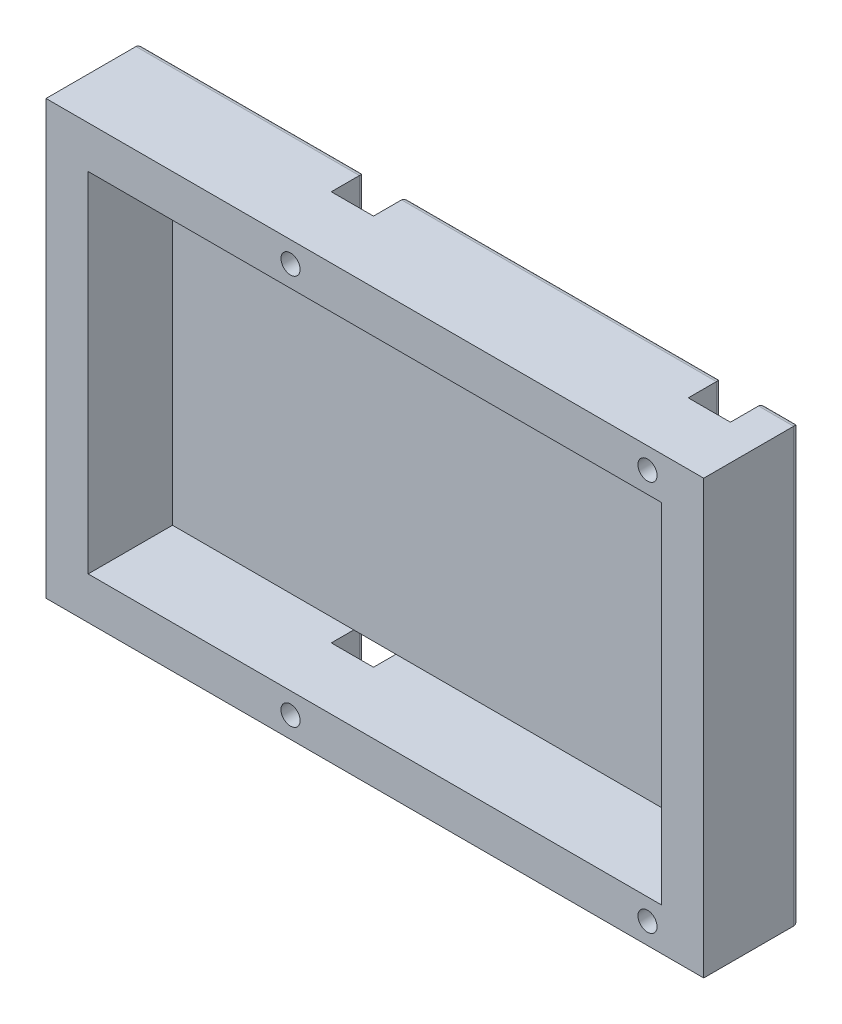
from build123d import *

# Parameters (mm, degrees)
SKETCH_1_W          = 117
SKETCH_1_H          = 77
EXTRUDE_1_DEPTH     = 17
SKETCH_2_W          = 102
SKETCH_2_H          = 62
CUT_EXTRUDE_1_DEPTH = 15
SKETCH_4_R          = 1.7
CUT_EXTRUDE_2_DEPTH = 73.065942025
SKETCH_5_W          = 7.5
SKETCH_5_H          = 7.5
CUT_EXTRUDE_3_DEPTH = 6
FILLET_2_R          = 1


with BuildPart() as part:
    # ｽｹｯﾁ1 → ﾎﾞｽ - 押し出し1 (new body)
    with BuildSketch(Plane.XY):
        Rectangle(SKETCH_1_W, SKETCH_1_H)
    extrude(amount=EXTRUDE_1_DEPTH)

    # ｽｹｯﾁ2 → ｶｯﾄ - 押し出し1 (cut)
    with BuildSketch(Plane.XY.offset(17)):
        Rectangle(SKETCH_2_W, SKETCH_2_H)
    extrude(amount=-CUT_EXTRUDE_1_DEPTH, mode=Mode.SUBTRACT)

    # ｽｹｯﾁ4 → ｶｯﾄ - 押し出し2 (cut, through all)
    with BuildSketch(Plane(origin=(0, 0, 0), x_dir=(-1, 0, 0), z_dir=(0, 0, -1))):
        with Locations((15, 34.75)):
            Circle(SKETCH_4_R)
        with Locations((15, -34.75)):
            Circle(SKETCH_4_R)
        with Locations((-48.5, -34.75)):
            Circle(SKETCH_4_R)
        with Locations((-48.5, 34.75)):
            Circle(SKETCH_4_R)
    extrude(amount=-CUT_EXTRUDE_2_DEPTH, mode=Mode.SUBTRACT)

    # ｽｹｯﾁ5 → ｶｯﾄ - 押し出し3 (cut)
    with BuildSketch(Plane(origin=(0, 0, 0), x_dir=(-1, 0, 0), z_dir=(0, 0, -1))):
        with Locations((-48.5, -34.75)):
            Rectangle(SKETCH_5_W, SKETCH_5_H)
        with Locations((-48.5, 34.75)):
            Rectangle(SKETCH_5_W, SKETCH_5_H)
        with Locations((15, 34.75)):
            Rectangle(SKETCH_5_W, SKETCH_5_H)
        with Locations((15, -34.75)):
            Rectangle(SKETCH_5_W, SKETCH_5_H)
    extrude(amount=-CUT_EXTRUDE_3_DEPTH, mode=Mode.SUBTRACT)

    # ﾌｨﾚｯﾄ2
    fillet_2_edges = [part.edges().sort_by_distance(p)[0] for p in [
        (44.75, 34.75, 0),
        (52.25, 34.75, 0),
        (48.5, 31, 0),
        (44.75, -34.75, 0),
        (48.5, -31, 0),
        (52.25, -34.75, 0),
        (55.375, 38.5, 0),
        (58.5, 0, 0),
        (-38.625, -38.5, 0),
        (-58.5, 0, 0),
        (16.75, 38.5, 0),
        (-38.625, 38.5, 0),
        (16.75, -38.5, 0),
        (55.375, -38.5, 0),
        (-18.75, -34.75, 0),
        (-15, -31, 0),
        (-11.25, -34.75, 0),
        (-18.75, 34.75, 0),
        (-11.25, 34.75, 0),
        (-15, 31, 0),
    ]]
    fillet(fillet_2_edges, radius=FILLET_2_R)


solid = part.part
